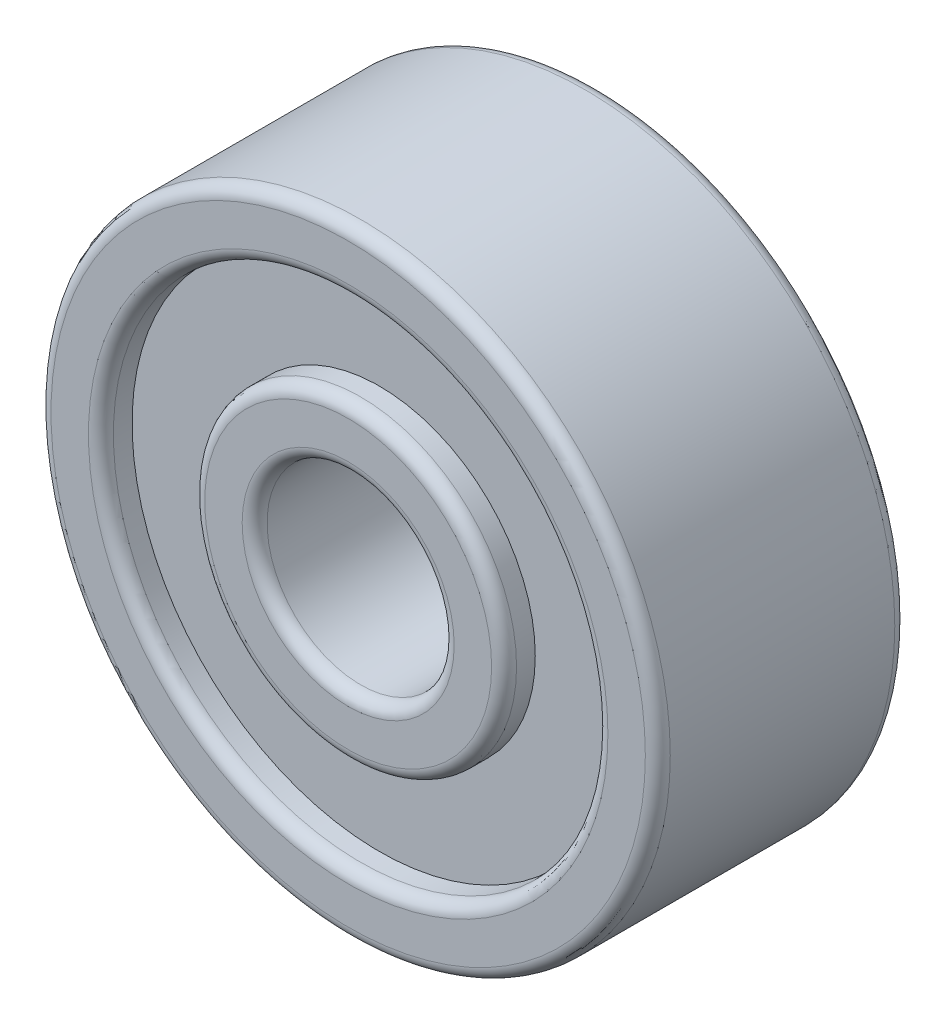
from build123d import *

# Parameters (mm, degrees)
CROQUIS1_R              = 4.965
CROQUIS1_R_2            = 1.5
SALIENTE_EXTRUIR1_DEPTH = 2
CROQUIS2_R              = 3.965
CROQUIS2_R_2            = 2.5
CORTAR_EXTRUIR1_DEPTH   = 0.5
REDONDEO1_R             = 0.2


with BuildPart() as part:
    # Croquis1 → Saliente-Extruir1 (new body)
    with BuildSketch(Plane.XY):
        Circle(CROQUIS1_R)
        Circle(CROQUIS1_R_2, mode=Mode.SUBTRACT)
    extrude(amount=SALIENTE_EXTRUIR1_DEPTH)

    # Croquis2 → Cortar-Extruir1 (cut)
    with BuildSketch(Plane.XY.offset(2)):
        Circle(CROQUIS2_R)
        Circle(CROQUIS2_R_2, mode=Mode.SUBTRACT)
    extrude(amount=-CORTAR_EXTRUIR1_DEPTH, mode=Mode.SUBTRACT)

    # Redondeo1
    redondeo1_edges = [part.edges().sort_by_distance(p)[0] for p in [
        (-3.965, 0, 2),
        (-2.5, 0, 2),
        (-4.965, 0, 2),
        (-1.5, 0, 2),
    ]]
    fillet(redondeo1_edges, radius=REDONDEO1_R)

    # Simetría3: part across plane


with BuildPart() as part_1:
    add(part.part)
    add(part.part.mirror(Plane.XY))


solid = part_1.part
